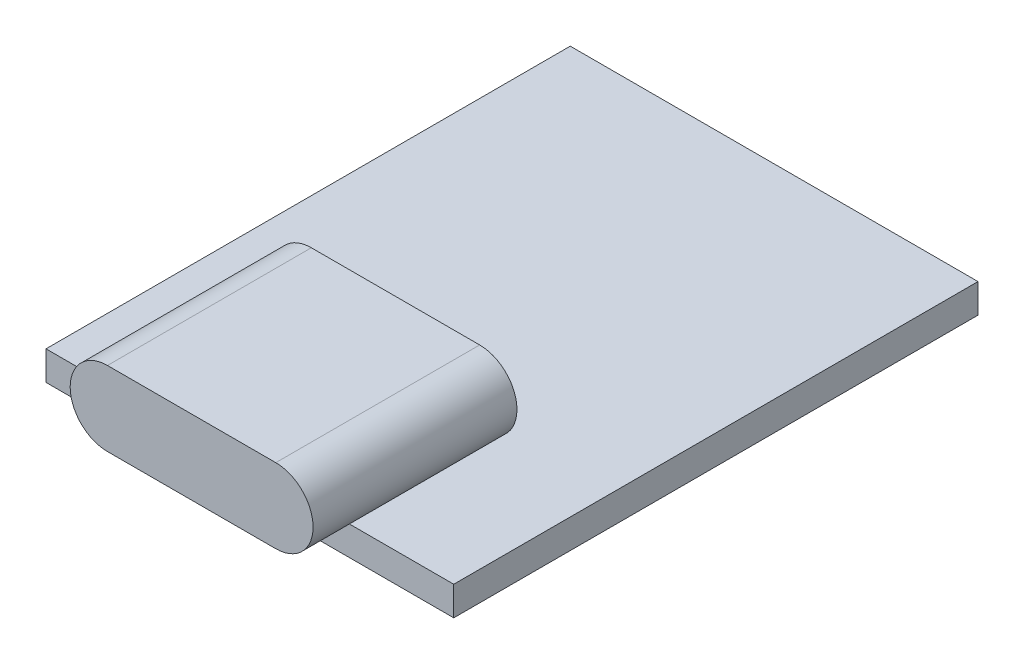
from build123d import *

# Parameters (mm, degrees)
SKETCH1_W                = 14
SKETCH1_H                = 18
BOSS_EXTRUDE1_DEPTH      = 1
BOSS_EXTRUDE2_DEPTH      = 2
BOSS_EXTRUDE2_DEPTH_BACK = 5
SKETCH2_W                = 5.78
SKETCH2_H                = 2.56


with BuildPart() as part:
    # Sketch1 → Boss-Extrude1 (new body)
    with BuildSketch(Plane(origin=(0, 0, 0), x_dir=(1, 0, 0), z_dir=(0, 1, 0))):
        with Locations((7, -9)):
            Rectangle(SKETCH1_W, SKETCH1_H)
    extrude(amount=BOSS_EXTRUDE1_DEPTH)

    # Sketch2 → Boss-Extrude2 (add, two sides: drawn at the far end of the back side and taken through both)
    with BuildSketch(Plane.XY.offset(18).offset(-BOSS_EXTRUDE2_DEPTH_BACK)):
        with BuildLine():
            Line((4.11, 3.56), (4.11, 1))
            ThreePointArc((4.11, 1), (2.83, 2.28), (4.11, 3.56))
        make_face()
        with Locations((7, 2.28)):
            Rectangle(SKETCH2_W, SKETCH2_H)
        with BuildLine():
            ThreePointArc((9.89, 3.56), (11.17, 2.28), (9.89, 1))
            Line((9.89, 1), (9.89, 3.56))
        make_face()
    extrude(amount=BOSS_EXTRUDE2_DEPTH + BOSS_EXTRUDE2_DEPTH_BACK)


solid = part.part
